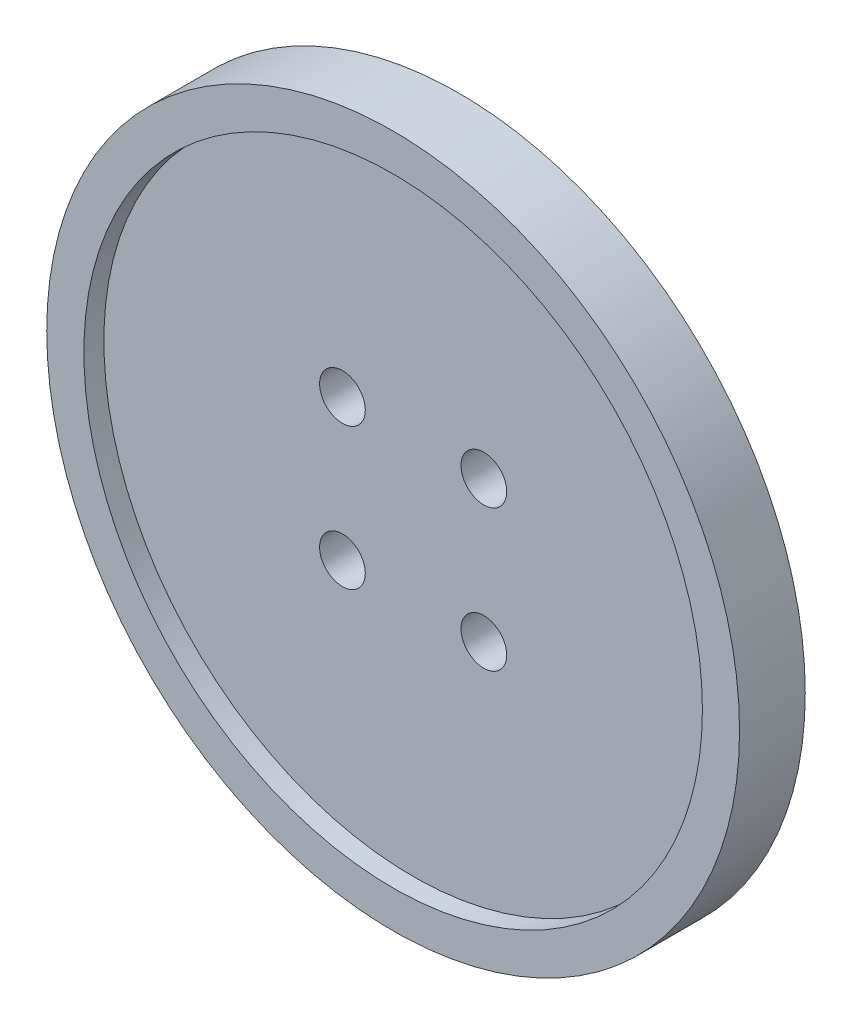
from build123d import *

# Parameters (mm, degrees)
SKETCH1_R           = 24.25
SKETCH1_R_2         = 1.6
BOSS_EXTRUDE1_DEPTH = 4.6
SKETCH2_R           = 21.65
CUT_EXTRUDE1_DEPTH  = 1.4


with BuildPart() as part:
    # Sketch1 → Boss-Extrude1 (new body)
    with BuildSketch(Plane.XY):
        Circle(SKETCH1_R)
        with Locations((-4.949747468, 4.949747468)):
            Circle(SKETCH1_R_2, mode=Mode.SUBTRACT)
        with Locations((4.949747468, 4.949747468)):
            Circle(SKETCH1_R_2, mode=Mode.SUBTRACT)
        with Locations((4.949747468, -4.949747468)):
            Circle(SKETCH1_R_2, mode=Mode.SUBTRACT)
        with Locations((-4.949747468, -4.949747468)):
            Circle(SKETCH1_R_2, mode=Mode.SUBTRACT)
    extrude(amount=BOSS_EXTRUDE1_DEPTH)

    # Sketch2 → Cut-Extrude1 (cut)
    with BuildSketch(Plane.XY.offset(4.6)):
        Circle(SKETCH2_R)
    extrude(amount=-CUT_EXTRUDE1_DEPTH, mode=Mode.SUBTRACT)


solid = part.part
